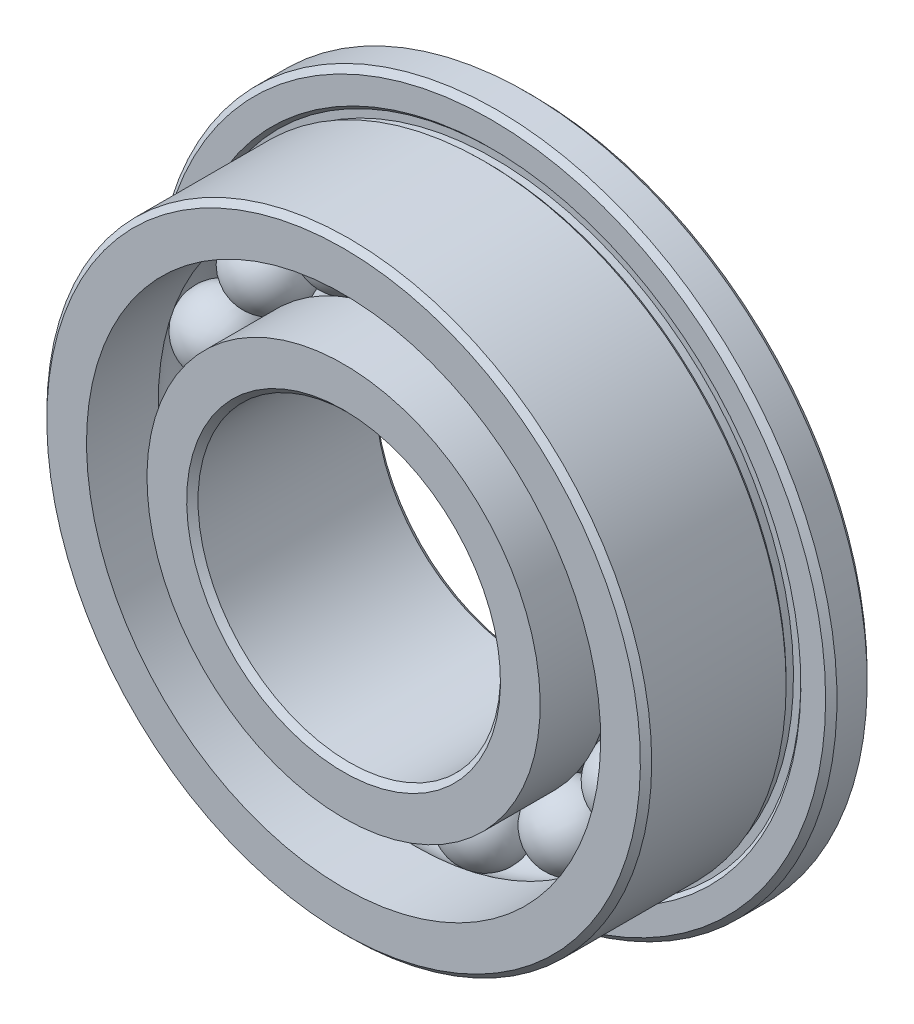
from build123d import *

# Parameters (mm, degrees)
FILLET1_SIZE      = 0.15
FILLET2_SIZE      = 0.15
CIRPATTERN3_COUNT = 15


with BuildPart() as part:
    # Sketch2 → Revolve1 (revolve)
    with BuildSketch(Plane(origin=(0, 0, 0), x_dir=(0, 0, -1), z_dir=(1, 0, 0))):
        with BuildLine():
            Line((2.5, 9), (1.4, 9))
            Line((1.4, 9), (1.4, 8.194454365))
            Line((1.4, 8.194454365), (1.497227182, 8.097227182))
            Line((1.497227182, 8.097227182), (1.497227182, 7.902772818))
            Line((1.497227182, 7.902772818), (1.302772818, 7.902772818))
            Line((1.302772818, 7.902772818), (1.205545635, 8))
            Line((1.205545635, 8), (-2.5, 8))
            Line((-2.5, 8), (-2.5, 6.8))
            Line((-2.5, 6.8), (-0.6, 6.8))
            ThreePointArc((-0.6, 6.8), (0, 7), (0.6, 6.8))
            Line((0.6, 6.8), (2.5, 6.8))
            Line((2.5, 6.8), (2.5, 9))
        make_face()
        with BuildLine():
            Line((2.5, 4), (-2.5, 4))
            Line((-2.5, 4), (-2.5, 5.2))
            Line((-2.5, 5.2), (-0.6, 5.2))
            ThreePointArc((-0.6, 5.2), (0, 5), (0.6, 5.2))
            Line((0.6, 5.2), (2.5, 5.2))
            Line((2.5, 5.2), (2.5, 4))
        make_face()
    revolve(axis=Axis((0, 0, 0), (0, 0, -1)))

    # Fillet1
    fillet1_edges = [part.edges().sort_by_distance(p)[0] for p in [
        (0, -9, -2.5),
        (0, -9, -1.4),
        (0, -8, 2.5),
    ]]
    chamfer(fillet1_edges, length=FILLET1_SIZE)

    # Fillet2
    fillet2_edges = [part.edges().sort_by_distance(p)[0] for p in [
        (0, -4, -2.5),
        (0, -4, 2.5),
    ]]
    chamfer(fillet2_edges, length=FILLET2_SIZE)


with BuildPart() as body_2:
    # Sketch7 → Revolve3 (revolve)
    with BuildSketch(Plane.XY):
        with BuildLine():
            Line((0, 7), (0, 5))
            ThreePointArc((0, 5), (-1, 6), (0, 7))
        make_face()
    revolve(axis=Axis((0, 7, 0), (0, -1, 0)))


with BuildPart() as cirpattern3_1:
    # CirPattern3: pattern copy
    add(body_2.part.rotate(Axis((0, 0, 0), (0, 0, -1)), 1 * 360 / CIRPATTERN3_COUNT))


with BuildPart() as cirpattern3_2:
    # CirPattern3: pattern copy
    add(body_2.part.rotate(Axis((0, 0, 0), (0, 0, -1)), 2 * 360 / CIRPATTERN3_COUNT))


with BuildPart() as cirpattern3_3:
    # CirPattern3: pattern copy
    add(body_2.part.rotate(Axis((0, 0, 0), (0, 0, -1)), 3 * 360 / CIRPATTERN3_COUNT))


with BuildPart() as cirpattern3_4:
    # CirPattern3: pattern copy
    add(body_2.part.rotate(Axis((0, 0, 0), (0, 0, -1)), 4 * 360 / CIRPATTERN3_COUNT))


with BuildPart() as cirpattern3_5:
    # CirPattern3: pattern copy
    add(body_2.part.rotate(Axis((0, 0, 0), (0, 0, -1)), 5 * 360 / CIRPATTERN3_COUNT))


with BuildPart() as cirpattern3_6:
    # CirPattern3: pattern copy
    add(body_2.part.rotate(Axis((0, 0, 0), (0, 0, -1)), 6 * 360 / CIRPATTERN3_COUNT))


with BuildPart() as cirpattern3_7:
    # CirPattern3: pattern copy
    add(body_2.part.rotate(Axis((0, 0, 0), (0, 0, -1)), 7 * 360 / CIRPATTERN3_COUNT))


with BuildPart() as cirpattern3_8:
    # CirPattern3: pattern copy
    add(body_2.part.rotate(Axis((0, 0, 0), (0, 0, -1)), 8 * 360 / CIRPATTERN3_COUNT))


with BuildPart() as cirpattern3_9:
    # CirPattern3: pattern copy
    add(body_2.part.rotate(Axis((0, 0, 0), (0, 0, -1)), 9 * 360 / CIRPATTERN3_COUNT))


with BuildPart() as cirpattern3_10:
    # CirPattern3: pattern copy
    add(body_2.part.rotate(Axis((0, 0, 0), (0, 0, -1)), 10 * 360 / CIRPATTERN3_COUNT))


with BuildPart() as cirpattern3_11:
    # CirPattern3: pattern copy
    add(body_2.part.rotate(Axis((0, 0, 0), (0, 0, -1)), 11 * 360 / CIRPATTERN3_COUNT))


with BuildPart() as cirpattern3_12:
    # CirPattern3: pattern copy
    add(body_2.part.rotate(Axis((0, 0, 0), (0, 0, -1)), 12 * 360 / CIRPATTERN3_COUNT))


with BuildPart() as cirpattern3_13:
    # CirPattern3: pattern copy
    add(body_2.part.rotate(Axis((0, 0, 0), (0, 0, -1)), 13 * 360 / CIRPATTERN3_COUNT))


with BuildPart() as cirpattern3_14:
    # CirPattern3: pattern copy
    add(body_2.part.rotate(Axis((0, 0, 0), (0, 0, -1)), 14 * 360 / CIRPATTERN3_COUNT))


solid = Compound([part.part, body_2.part, cirpattern3_1.part, cirpattern3_2.part, cirpattern3_3.part, cirpattern3_4.part, cirpattern3_5.part, cirpattern3_6.part, cirpattern3_7.part, cirpattern3_8.part, cirpattern3_9.part, cirpattern3_10.part, cirpattern3_11.part, cirpattern3_12.part, cirpattern3_13.part, cirpattern3_14.part])
